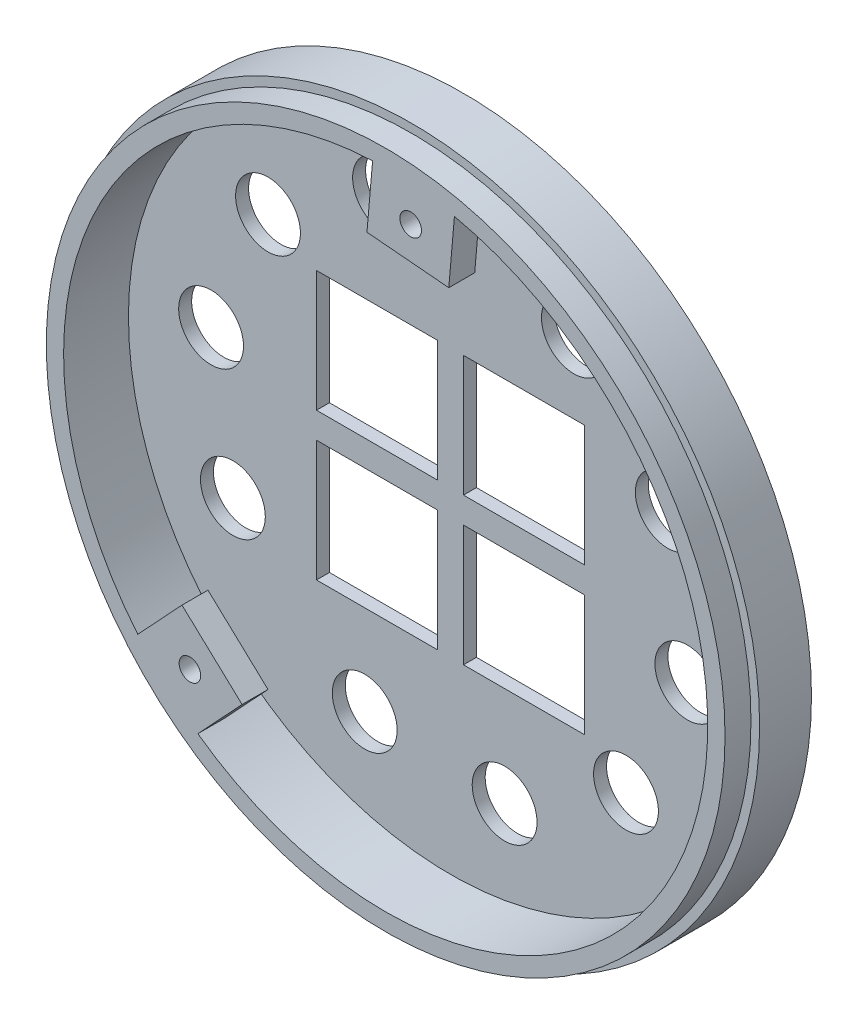
from build123d import *
from build123d.topology import SkipClean

# Parameters (mm, degrees)
SKETCH2_R           = 39.25
SKETCH2_R_2         = 1.25
BOSS_EXTRUDE1_DEPTH = 3
BOSS_EXTRUDE2_START = -6
SKETCH3_R           = 40.25
SKETCH3_R_2         = 37.25
SKETCH3_R_3         = 1.25
BOSS_EXTRUDE2_DEPTH = 6
SKETCH4_R           = 40.25
BOSS_EXTRUDE3_DEPTH = 1.5
SKETCH5_W           = 14
SKETCH5_H           = 14
CUT_EXTRUDE1_DEPTH  = 1.5
SKETCH7_R           = 3.75
CUT_EXTRUDE2_DEPTH  = 1.5


with BuildPart() as part:
    # Sketch2 → Boss-Extrude1 (new body)
    with BuildSketch(Plane(origin=(0, 0, 0), x_dir=(0, 1, 0), z_dir=(0, 0, 1))):
        with Locations(Location((0, 0, 0), (0, 0, 270))):
            Circle(SKETCH2_R)
        with BuildLine():
            Line((-18.29588, 23.55599), (-23.781033, 28.670978))
            ThreePointArc((-23.781033, 28.670978), (15.15094, 34.029568), (37.219306, 1.511877))
            Line((37.219306, 1.511877), (29.747846, 2.165545))
            Line((29.747846, 2.165545), (28.919866, -7.298305))
            Line((28.919866, -7.298305), (36.391326, -7.951973))
            ThreePointArc((36.391326, -7.951973), (-15.15094, -34.029568), (-30.260018, 21.723117))
            Line((-30.260018, 21.723117), (-24.774865, 16.60813))
            Line((-24.774865, 16.60813), (-18.29588, 23.55599))
        make_face(mode=Mode.SUBTRACT)
        with Locations(Location((-24.277949, 22.639554, 0), (0, 0, 270))):
            Circle(SKETCH2_R_2, mode=Mode.SUBTRACT)
        with Locations(Location((33.069586, -2.893214, 0), (0, 0, 270))):
            Circle(SKETCH2_R_2, mode=Mode.SUBTRACT)
    extrude(amount=BOSS_EXTRUDE1_DEPTH)

    # Sketch3 → Boss-Extrude2 (add)
    # profile 1 of 3: a face of its own
    with SkipClean():  # the faces are left unmerged after this step: merging them gives an invalid solid
        with BuildSketch(Plane.XY.offset(BOSS_EXTRUDE2_START)):
            with Locations(Location((0, 0, 0), (0, 0, 180))):
                Circle(SKETCH3_R)
            with Locations(Location((0, 0, 0), (0, 0, 219.67388))):
                Circle(SKETCH3_R_2, mode=Mode.SUBTRACT)
        # profile 2 of 3: a face of its own
        with BuildSketch(Plane.XY.offset(BOSS_EXTRUDE2_START)):
            with Locations((2.893214, 33.069586)):
                Circle(SKETCH3_R_3)
        # profile 3 of 3: a face of its own
        with BuildSketch(Plane.XY.offset(BOSS_EXTRUDE2_START)):
            with Locations((-22.639554, -24.277949)):
                Circle(SKETCH3_R_3)
        extrude(amount=BOSS_EXTRUDE2_DEPTH)


with BuildPart() as boss_extrude2_kept_piece:
    # of the separate pieces the step leaves, the one the design keeps (boss_extrude2_pieces_kept)
    add(part.part.solids().sort_by_distance((39.25, 0, 0))[0])

    # Sketch4 → Boss-Extrude3 (add)
    with SkipClean():  # the faces are left unmerged after this step: merging them gives an invalid solid
        with BuildSketch(Plane.XY.offset(-6)):
            with Locations(Location((0, 0, 0), (0, 0, 180))):
                Circle(SKETCH4_R)
        extrude(amount=BOSS_EXTRUDE3_DEPTH)

    # Sketch5 → Cut-Extrude1 (cut)
    with SkipClean():  # the faces are left unmerged after this step: merging them gives an invalid solid
        with BuildSketch(Plane(origin=(0, 0, -6), x_dir=(-1, 0, 0), z_dir=(0, 0, -1))):
            with Locations((-8.5, -8.5)):
                Rectangle(SKETCH5_W, SKETCH5_H)
            with Locations((-8.5, 8.5)):
                Rectangle(SKETCH5_W, SKETCH5_H)
            with Locations((8.5, 8.5)):
                Rectangle(SKETCH5_W, SKETCH5_H)
            with Locations((8.5, -8.5)):
                Rectangle(SKETCH5_W, SKETCH5_H)
        extrude(amount=-CUT_EXTRUDE1_DEPTH, mode=Mode.SUBTRACT)

    # Sketch7 → Cut-Extrude2 (cut)
    with SkipClean():  # the faces are left unmerged after this step: merging them gives an invalid solid
        with BuildSketch(Plane(origin=(0, 0, -6), x_dir=(-1, 0, 0), z_dir=(0, 0, -1))):
            with Locations((-25.126958, 11.736458)):
                Circle(SKETCH7_R)
            with Locations((-27.394136, -4.320851)):
                Circle(SKETCH7_R)
            with Locations((-20.294579, -18.900755)):
                Circle(SKETCH7_R)
            with Locations((-6.2558, -27.01802)):
                Circle(SKETCH7_R)
            with Locations((9.921992, -25.897153)):
                Circle(SKETCH7_R)
            with Locations((25.168506, -12.130508)):
                Circle(SKETCH7_R)
            with Locations((27.693803, 3.695429)):
                Circle(SKETCH7_R)
            with Locations((21.107164, 18.305479)):
                Circle(SKETCH7_R)
            with Locations((7.575753, 26.892581)):
                Circle(SKETCH7_R)
            with Locations((-14.268248, 23.780781)):
                Circle(SKETCH7_R)
        extrude(amount=-CUT_EXTRUDE2_DEPTH, mode=Mode.SUBTRACT)


solid = boss_extrude2_kept_piece.part
